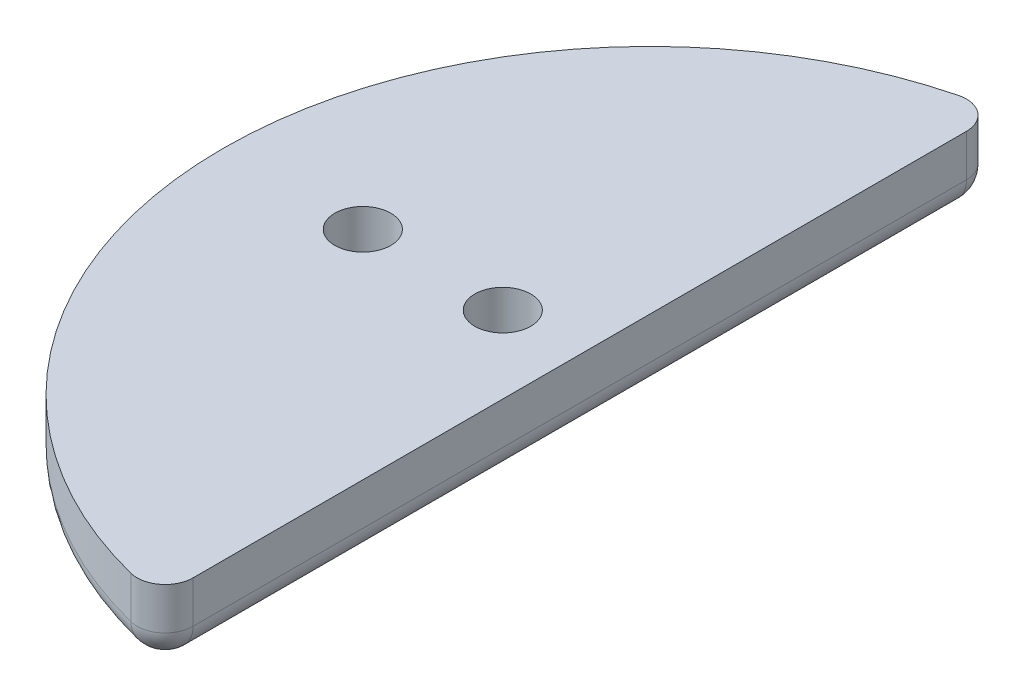
from build123d import *

# Parameters (mm, degrees)
BOSS_EXTRUDE2_DEPTH       = 5
F_4_0MM_DOWEL_HOLE1_D     = 4
F_4_0MM_DOWEL_HOLE1_DEPTH = 117.6291
F_4_0MM_DOWEL_HOLE1_TIP   = 1.201721238
FILLET1_R                 = 2


with BuildPart() as part:
    # Sketch2 → Boss-Extrude2 (new body)
    with BuildSketch(Plane(origin=(0, 0, 0), x_dir=(1, 0, 0), z_dir=(0, 1, 0))):
        with BuildLine():
            Line((-5, 30.087372767), (-5, -30.087372767))
            ThreePointArc((-5, -30.087372767), (-30.5, 0), (-5, 30.087372767))
        make_face()
    extrude(amount=BOSS_EXTRUDE2_DEPTH)

    # Ø4.0mm Dowel Hole1
    with Locations(Plane.XZ):
        with Locations((-20.5, 0), (-10.5, 0)):
            Hole(F_4_0MM_DOWEL_HOLE1_D / 2, depth=F_4_0MM_DOWEL_HOLE1_DEPTH)
            with Locations((0, 0, -(F_4_0MM_DOWEL_HOLE1_DEPTH + F_4_0MM_DOWEL_HOLE1_TIP / 2))):  # 118° drill point
                Cone(0, F_4_0MM_DOWEL_HOLE1_D / 2, F_4_0MM_DOWEL_HOLE1_TIP, mode=Mode.SUBTRACT)

    # Fillet1
    fillet1_edges = [part.edges().sort_by_distance(p)[0] for p in [
        (-5, 0, 0),
        (-30.5, 0, 0),
        (-5, 2.5, -30.087372767),
        (-5, 2.5, 30.087372767),
    ]]
    fillet(fillet1_edges, radius=FILLET1_R)


solid = part.part
